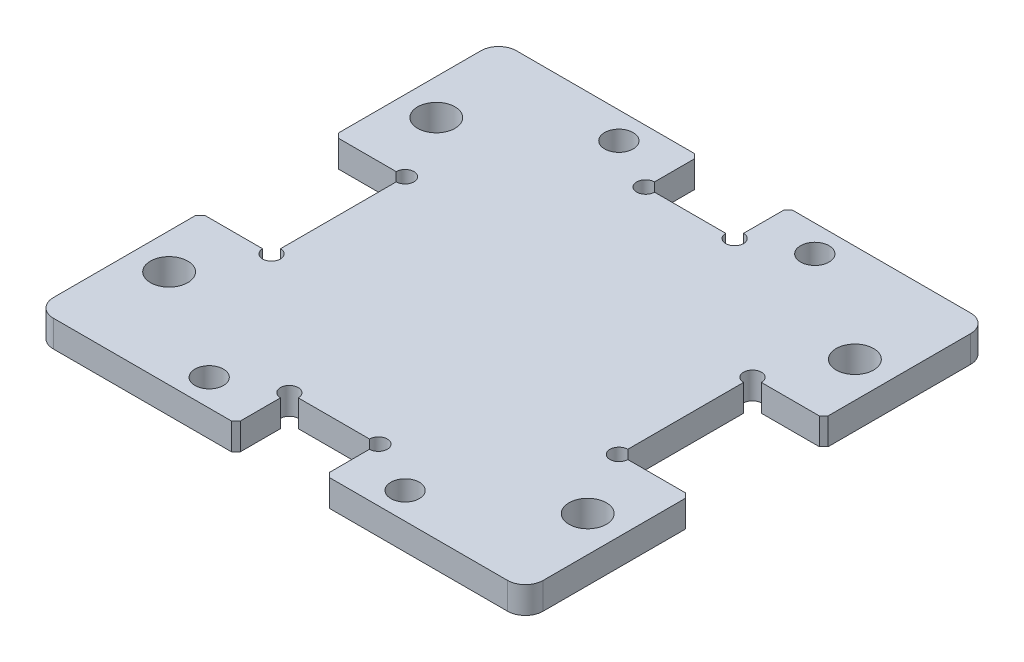
from build123d import *

# Parameters (mm, degrees)
SKETCH_1_W          = 55
SKETCH_1_H          = 52
EXTRUDE_1_DEPTH     = 3
SKETCH_2_W          = 10
SKETCH_2_H          = 6
CUT_EXTRUDE_1_DEPTH = 38.963798545
SKETCH_3_R          = 1
CUT_EXTRUDE_2_DEPTH = 38.963798545
SKETCH_4_R          = 1.6
CUT_EXTRUDE_3_DEPTH = 38.963798545
CHAMFER_1_SIZE      = 0.5
SKETCH_5_W          = 8
SKETCH_5_H          = 15
CUT_EXTRUDE_4_DEPTH = 38.963798545
SKETCH_6_R          = 1
CUT_EXTRUDE_5_DEPTH = 38.963798545
SKETCH_7_R          = 2.1
CUT_EXTRUDE_6_DEPTH = 38.963798545
CHAMFER_2_SIZE      = 0.5
FILLET_1_R          = 2


with BuildPart() as part:
    # 草图1 → 凸台-拉伸1 (new body)
    with BuildSketch(Plane(origin=(0, 0, 0), x_dir=(1, 0, 0), z_dir=(0, 1, 0))):
        Rectangle(SKETCH_1_W, SKETCH_1_H)
    extrude(amount=EXTRUDE_1_DEPTH)

    # 草图2 → 切除-拉伸1 (cut, through all)
    with BuildSketch(Plane(origin=(0, 3, 0), x_dir=(1, 0, 0), z_dir=(0, 1, 0))):
        with Locations((0, -23)):
            Rectangle(SKETCH_2_W, SKETCH_2_H)
        with Locations((0, 23)):
            Rectangle(SKETCH_2_W, SKETCH_2_H)
    extrude(amount=-CUT_EXTRUDE_1_DEPTH, mode=Mode.SUBTRACT)

    # 草图3 → 切除-拉伸2 (cut, through all)
    with BuildSketch(Plane(origin=(0, 3, 0), x_dir=(1, 0, 0), z_dir=(0, 1, 0))):
        with Locations((-5, 20)):
            Circle(SKETCH_3_R)
        with Locations((5, 20)):
            Circle(SKETCH_3_R)
        with Locations((-5, -20)):
            Circle(SKETCH_3_R)
        with Locations((5, -20)):
            Circle(SKETCH_3_R)
    extrude(amount=-CUT_EXTRUDE_2_DEPTH, mode=Mode.SUBTRACT)

    # 草图4 → 切除-拉伸3 (cut, through all)
    with BuildSketch(Plane(origin=(0, 3, 0), x_dir=(1, 0, 0), z_dir=(0, 1, 0))):
        with Locations(Location((-11, -23, 0), (0, 0, 270))):
            Circle(SKETCH_4_R)
        with Locations(Location((11, -23, 0), (0, 0, 90))):
            Circle(SKETCH_4_R)
        with Locations(Location((11, 23, 0), (0, 0, 270))):
            Circle(SKETCH_4_R)
        with Locations(Location((-11, 23, 0), (0, 0, 90))):
            Circle(SKETCH_4_R)
    extrude(amount=-CUT_EXTRUDE_3_DEPTH, mode=Mode.SUBTRACT)

    # 倒角1
    chamfer_1_edges = [part.edges().sort_by_distance(p)[0] for p in [
        (5, 1.5, 26),
        (-5, 1.5, 26),
        (-5, 1.5, -26),
        (5, 1.5, -26),
    ]]
    chamfer(chamfer_1_edges, length=CHAMFER_1_SIZE)

    # 草图5 → 切除-拉伸4 (cut, through all)
    with BuildSketch(Plane(origin=(0, 3, 0), x_dir=(1, 0, 0), z_dir=(0, 1, 0))):
        with Locations((-23.5, 0)):
            Rectangle(SKETCH_5_W, SKETCH_5_H)
        with Locations((23.5, 0)):
            Rectangle(SKETCH_5_W, SKETCH_5_H)
    extrude(amount=-CUT_EXTRUDE_4_DEPTH, mode=Mode.SUBTRACT)

    # 草图6 → 切除-拉伸5 (cut, through all)
    with BuildSketch(Plane(origin=(0, 3, 0), x_dir=(1, 0, 0), z_dir=(0, 1, 0))):
        with Locations((19.5, 7.5)):
            Circle(SKETCH_6_R)
        with Locations((19.5, -7.5)):
            Circle(SKETCH_6_R)
        with Locations((-19.5, 7.5)):
            Circle(SKETCH_6_R)
        with Locations((-19.5, -7.5)):
            Circle(SKETCH_6_R)
    extrude(amount=-CUT_EXTRUDE_5_DEPTH, mode=Mode.SUBTRACT)

    # 草图7 → 切除-拉伸6 (cut, through all)
    with BuildSketch(Plane(origin=(0, 3, 0), x_dir=(1, 0, 0), z_dir=(0, 1, 0))):
        with Locations(Location((-23.5, 15, 0), (0, 0, 270))):
            Circle(SKETCH_7_R)
        with Locations(Location((-23.5, -15, 0), (0, 0, 90))):
            Circle(SKETCH_7_R)
        with Locations(Location((23.5, -15, 0), (0, 0, 270))):
            Circle(SKETCH_7_R)
        with Locations(Location((23.5, 15, 0), (0, 0, 90))):
            Circle(SKETCH_7_R)
    extrude(amount=-CUT_EXTRUDE_6_DEPTH, mode=Mode.SUBTRACT)

    # 倒角2
    chamfer_2_edges = [part.edges().sort_by_distance(p)[0] for p in [
        (-27.5, 1.5, 7.5),
        (-27.5, 1.5, -7.5),
        (27.5, 1.5, 7.5),
        (27.5, 1.5, -7.5),
    ]]
    chamfer(chamfer_2_edges, length=CHAMFER_2_SIZE)

    # 圆角1
    fillet_1_edges = [part.edges().sort_by_distance(p)[0] for p in [
        (27.5, 1.5, 26),
        (-27.5, 1.5, 26),
        (-27.5, 1.5, -26),
        (27.5, 1.5, -26),
    ]]
    fillet(fillet_1_edges, radius=FILLET_1_R)


solid = part.part
